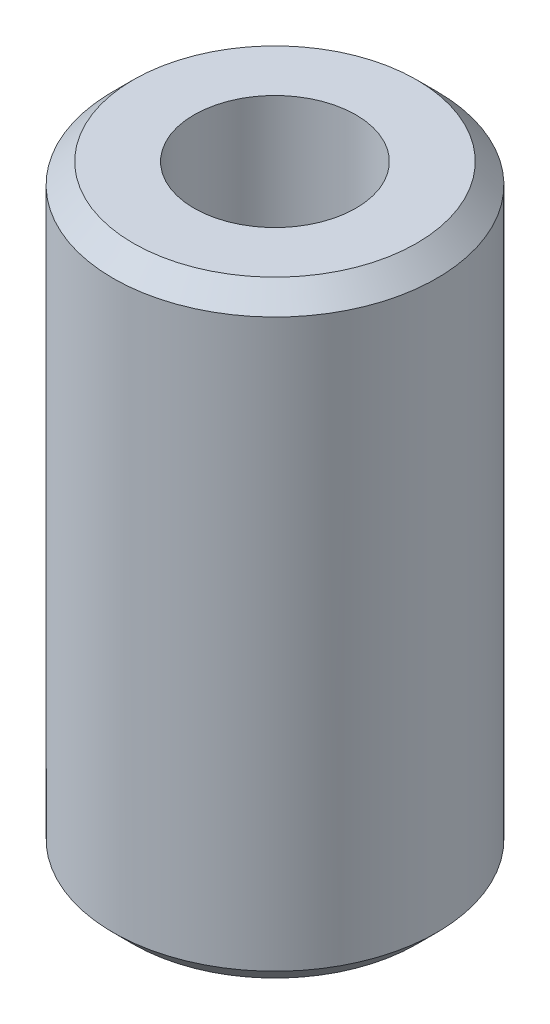
from build123d import *

# Parameters (mm, degrees)
CHAMFER_1_SIZE = 1


with BuildPart() as part:
    # Эскиз1 → Повернуть1 (revolve)
    with BuildSketch(Plane.XY, mode=Mode.PRIVATE) as revolve_1_sk:
        Polygon((8, 0), (8, 30), (4, 30), (4, 20), (1, 17), (1, 13), (4, 10), (4, 0), align=None)
    revolve(revolve_1_sk.sketch.rotate(Axis((0, 0, 0), (0, 1, 0)), 90), axis=Axis((0, 0, 0), (0, 1, 0)))

    # Фаска1
    chamfer_1_edges = [part.edges().sort_by_distance(p)[0] for p in [
        (0, 0, 8),
        (0, 30, 8),
    ]]
    chamfer(chamfer_1_edges, length=CHAMFER_1_SIZE)


solid = part.part
